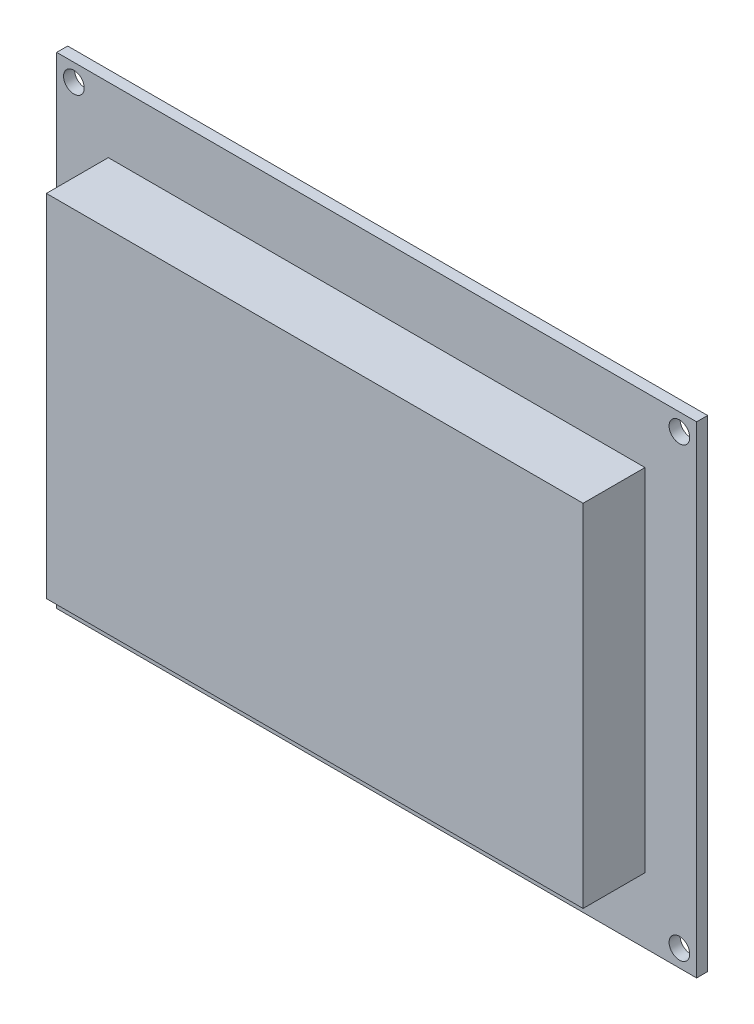
from build123d import *

# Parameters (mm, degrees)
SKETCH_1_W          = 93
SKETCH_1_H          = 70
EXTRUDE_1_DEPTH     = 1.6
SKETCH_2_R          = 1.5
CUT_EXTRUDE_1_DEPTH = 117.411167849
SKETCH_3_W          = 78
SKETCH_3_H          = 51
EXTRUDE_2_DEPTH     = 9
SKETCH_4_W          = 51
SKETCH_4_H          = 2.2
EXTRUDE_3_DEPTH     = 8
SKETCH_5_R          = 0.4
EXTRUDE_4_DEPTH     = 2


with BuildPart() as part:
    # 草图1 → 凸台-拉伸1 (new body)
    with BuildSketch(Plane.XY):
        with Locations((46.5, 35)):
            Rectangle(SKETCH_1_W, SKETCH_1_H)
    extrude(amount=EXTRUDE_1_DEPTH)

    # 草图2 → 切除-拉伸1 (cut, through all)
    with BuildSketch(Plane.XY.offset(1.6)):
        with Locations((2.5, 2.5)):
            Circle(SKETCH_2_R)
        with Locations((90.5, 2.5)):
            Circle(SKETCH_2_R)
        with Locations((90.5, 67.5)):
            Circle(SKETCH_2_R)
        with Locations((2.5, 67.5)):
            Circle(SKETCH_2_R)
    extrude(amount=-CUT_EXTRUDE_1_DEPTH, mode=Mode.SUBTRACT)

    # 草图3 → 凸台-拉伸2 (add)
    with BuildSketch(Plane.XY.offset(1.6)):
        with Locations((46.5, 35)):
            Rectangle(SKETCH_3_W, SKETCH_3_H)
    extrude(amount=EXTRUDE_2_DEPTH)

    # 草图4 → 凸台-拉伸3 (add)
    with BuildSketch(Plane(origin=(0, 0, 0), x_dir=(-1, 0, 0), z_dir=(0, 0, -1))):
        with Locations((-39.5, 2.5)):
            Rectangle(SKETCH_4_W, SKETCH_4_H)
    extrude(amount=EXTRUDE_3_DEPTH)

    # 草图5 → 凸台-拉伸4 (add)
    with BuildSketch(Plane(origin=(0, 0, -8), x_dir=(-1, 0, 0), z_dir=(0, 0, -1))):
        with Locations(Location((-38.23, 2.5, 0), (0, 0, 180))):
            Circle(SKETCH_5_R)
        with Locations(Location((-40.77, 2.5, 0), (0, 0, 180))):
            Circle(SKETCH_5_R)
        with Locations(Location((-43.31, 2.5, 0), (0, 0, 180))):
            Circle(SKETCH_5_R)
        with Locations(Location((-45.85, 2.5, 0), (0, 0, 180))):
            Circle(SKETCH_5_R)
        with Locations(Location((-48.39, 2.5, 0), (0, 0, 180))):
            Circle(SKETCH_5_R)
        with Locations(Location((-50.93, 2.5, 0), (0, 0, 180))):
            Circle(SKETCH_5_R)
        with Locations(Location((-53.47, 2.5, 0), (0, 0, 180))):
            Circle(SKETCH_5_R)
        with Locations(Location((-56.01, 2.5, 0), (0, 0, 180))):
            Circle(SKETCH_5_R)
        with Locations(Location((-58.55, 2.5, 0), (0, 0, 180))):
            Circle(SKETCH_5_R)
        with Locations(Location((-61.09, 2.5, 0), (0, 0, 180))):
            Circle(SKETCH_5_R)
        with Locations(Location((-63.63, 2.5, 0), (0, 0, 180))):
            Circle(SKETCH_5_R)
        with Locations(Location((-35.69, 2.5, 0), (0, 0, 180))):
            Circle(SKETCH_5_R)
        with Locations(Location((-33.15, 2.5, 0), (0, 0, 180))):
            Circle(SKETCH_5_R)
        with Locations(Location((-30.61, 2.5, 0), (0, 0, 180))):
            Circle(SKETCH_5_R)
        with Locations(Location((-28.07, 2.5, 0), (0, 0, 180))):
            Circle(SKETCH_5_R)
        with Locations(Location((-25.53, 2.5, 0), (0, 0, 180))):
            Circle(SKETCH_5_R)
        with Locations(Location((-22.99, 2.5, 0), (0, 0, 180))):
            Circle(SKETCH_5_R)
        with Locations(Location((-20.45, 2.5, 0), (0, 0, 180))):
            Circle(SKETCH_5_R)
        with Locations(Location((-17.91, 2.5, 0), (0, 0, 180))):
            Circle(SKETCH_5_R)
        with Locations(Location((-15.37, 2.5, 0), (0, 0, 180))):
            Circle(SKETCH_5_R)
    extrude(amount=EXTRUDE_4_DEPTH)


solid = part.part
